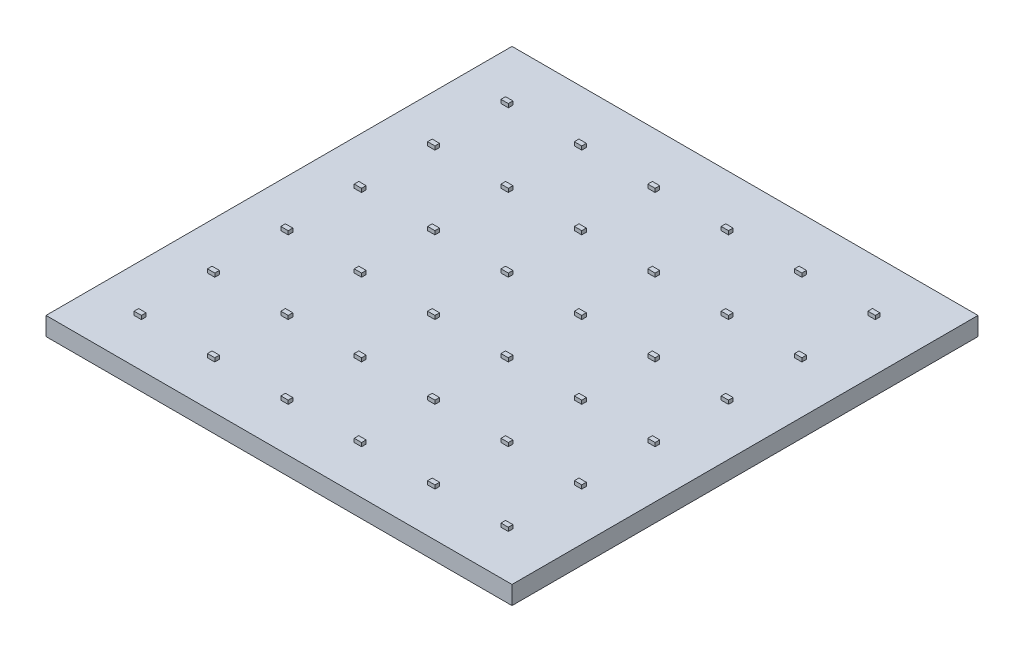
from build123d import *

# Parameters (mm, degrees)
SKETCH4_W           = 127
SKETCH4_H           = 127
BOSS_EXTRUDE5_DEPTH = 5
SKETCH5_W           = 2
SKETCH5_H           = 1.25
BOSS_EXTRUDE6_DEPTH = 1


with BuildPart() as part:
    # Sketch4 → Boss-Extrude5 (new body)
    with BuildSketch(Plane(origin=(0, 0, 0), x_dir=(1, 0, 0), z_dir=(0, 1, 0))):
        with Locations((-10.766435986, 25.92733564)):
            Rectangle(SKETCH4_W, SKETCH4_H)
    extrude(amount=BOSS_EXTRUDE5_DEPTH)

    # Sketch5 → Boss-Extrude6 (add)
    with BuildSketch(Plane(origin=(0, 5, 0), x_dir=(1, 0, 0), z_dir=(0, 1, 0))):
        with Locations((-41.266435986, -24.94766436)):
            Rectangle(SKETCH5_W, SKETCH5_H)
        with Locations((-61.266435986, -24.94766436)):
            Rectangle(SKETCH5_W, SKETCH5_H)
        with Locations((-21.266435986, -24.94766436)):
            Rectangle(SKETCH5_W, SKETCH5_H)
        with Locations((-1.266435986, -24.94766436)):
            Rectangle(SKETCH5_W, SKETCH5_H)
        with Locations((18.733564014, -24.94766436)):
            Rectangle(SKETCH5_W, SKETCH5_H)
        with Locations((38.733564014, -24.94766436)):
            Rectangle(SKETCH5_W, SKETCH5_H)
        with Locations((-41.266435986, -4.94766436)):
            Rectangle(SKETCH5_W, SKETCH5_H)
        with Locations((-21.266435986, -4.94766436)):
            Rectangle(SKETCH5_W, SKETCH5_H)
        with Locations((-1.266435986, -4.94766436)):
            Rectangle(SKETCH5_W, SKETCH5_H)
        with Locations((18.733564014, -4.94766436)):
            Rectangle(SKETCH5_W, SKETCH5_H)
        with Locations((38.733564014, -4.94766436)):
            Rectangle(SKETCH5_W, SKETCH5_H)
        with Locations((-41.266435986, 15.05233564)):
            Rectangle(SKETCH5_W, SKETCH5_H)
        with Locations((-21.266435986, 15.05233564)):
            Rectangle(SKETCH5_W, SKETCH5_H)
        with Locations((-1.266435986, 15.05233564)):
            Rectangle(SKETCH5_W, SKETCH5_H)
        with Locations((18.733564014, 15.05233564)):
            Rectangle(SKETCH5_W, SKETCH5_H)
        with Locations((38.733564014, 15.05233564)):
            Rectangle(SKETCH5_W, SKETCH5_H)
        with Locations((-41.266435986, 35.05233564)):
            Rectangle(SKETCH5_W, SKETCH5_H)
        with Locations((-21.266435986, 35.05233564)):
            Rectangle(SKETCH5_W, SKETCH5_H)
        with Locations((-1.266435986, 35.05233564)):
            Rectangle(SKETCH5_W, SKETCH5_H)
        with Locations((18.733564014, 35.05233564)):
            Rectangle(SKETCH5_W, SKETCH5_H)
        with Locations((38.733564014, 35.05233564)):
            Rectangle(SKETCH5_W, SKETCH5_H)
        with Locations((-41.266435986, 55.05233564)):
            Rectangle(SKETCH5_W, SKETCH5_H)
        with Locations((-21.266435986, 55.05233564)):
            Rectangle(SKETCH5_W, SKETCH5_H)
        with Locations((-1.266435986, 55.05233564)):
            Rectangle(SKETCH5_W, SKETCH5_H)
        with Locations((18.733564014, 55.05233564)):
            Rectangle(SKETCH5_W, SKETCH5_H)
        with Locations((38.733564014, 55.05233564)):
            Rectangle(SKETCH5_W, SKETCH5_H)
        with Locations((-41.266435986, 75.05233564)):
            Rectangle(SKETCH5_W, SKETCH5_H)
        with Locations((-21.266435986, 75.05233564)):
            Rectangle(SKETCH5_W, SKETCH5_H)
        with Locations((-1.266435986, 75.05233564)):
            Rectangle(SKETCH5_W, SKETCH5_H)
        with Locations((18.733564014, 75.05233564)):
            Rectangle(SKETCH5_W, SKETCH5_H)
        with Locations((38.733564014, 75.05233564)):
            Rectangle(SKETCH5_W, SKETCH5_H)
        with Locations((-61.266435986, -4.94766436)):
            Rectangle(SKETCH5_W, SKETCH5_H)
        with Locations((-61.266435986, 15.05233564)):
            Rectangle(SKETCH5_W, SKETCH5_H)
        with Locations((-61.266435986, 35.05233564)):
            Rectangle(SKETCH5_W, SKETCH5_H)
        with Locations((-61.266435986, 55.05233564)):
            Rectangle(SKETCH5_W, SKETCH5_H)
        with Locations((-61.266435986, 75.05233564)):
            Rectangle(SKETCH5_W, SKETCH5_H)
    extrude(amount=BOSS_EXTRUDE6_DEPTH)


solid = part.part
